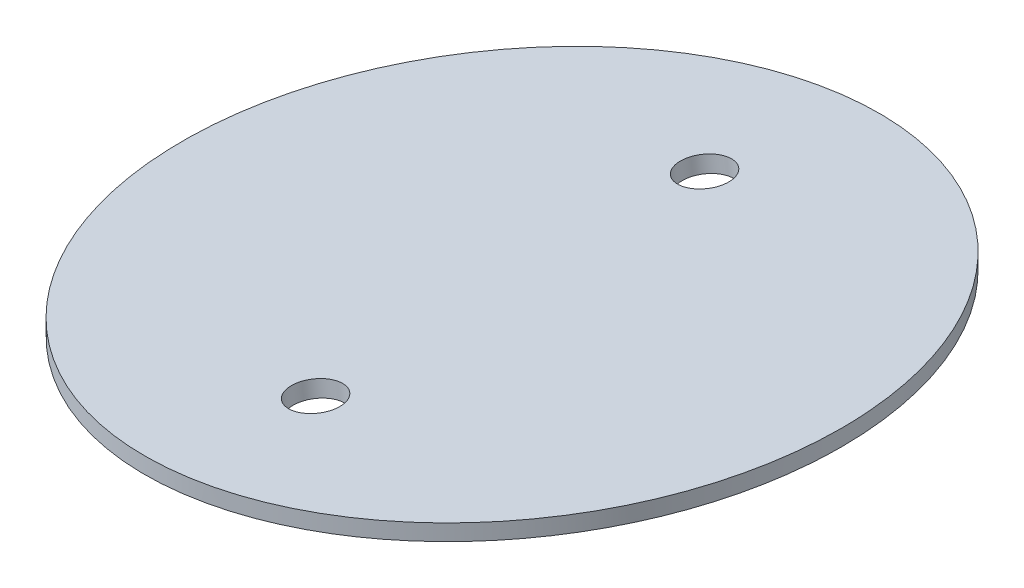
from build123d import *

# Parameters (mm, degrees)
BOSS_EXTRUDE1_DEPTH     = 61
CUT_EXTRUDE7_DEPTH      = 69.401456719
CUT_EXTRUDE7_DEPTH_BACK = 69.401456719
CUT_EXTRUDE9_DEPTH      = 69.480850828
CUT_EXTRUDE9_DEPTH_BACK = 69.480850828
SKETCH11_R              = 2.25


with BuildPart() as part:
    # Sketch1 → Boss-Extrude1 (new body)
    with BuildSketch(Plane.XY):
        Polygon((-30.5, -2.244929108), (-30.5, -3.744929108), (30.5, 3.744929108), (30.5, 5.244929108), align=None)
    extrude(amount=BOSS_EXTRUDE1_DEPTH)

    # Sketch7 → Cut-Extrude7 (cut, two sides: drawn at the far end of the back side and taken through both)
    with BuildSketch(Plane(origin=(0, 0, 0), x_dir=(1, 0, 0), z_dir=(0, 1, 0)).offset(-CUT_EXTRUDE7_DEPTH_BACK)):
        with BuildLine():
            Line((9.4e-08, 0), (-30.5, 0))
            Line((-30.5, 0), (-30.5, -30.5))
            ThreePointArc((-30.5, -30.5), (-21.566756793, -8.933243141), (9.4e-08, 0))
        make_face()
        with BuildLine():
            Line((30.5, 0), (9.4e-08, 0))
            ThreePointArc((9.4e-08, 0), (21.566756859, -8.933243207), (30.5, -30.5))
            Line((30.5, -30.5), (30.5, 0))
        make_face()
        with BuildLine():
            ThreePointArc((-8e-09, -61), (-21.566756829, -52.066756823), (-30.5, -30.5))
            Line((-30.5, -30.5), (-30.5, -61))
            Line((-30.5, -61), (-8e-09, -61))
        make_face()
        with BuildLine():
            Line((30.5, -61), (30.5, -30.5))
            ThreePointArc((30.5, -30.5), (21.566756823, -52.066756829), (-8e-09, -61))
            Line((-8e-09, -61), (30.5, -61))
        make_face()
    extrude(amount=CUT_EXTRUDE7_DEPTH + CUT_EXTRUDE7_DEPTH_BACK, mode=Mode.SUBTRACT)

    # Sketch11 → Cut-Extrude9 (cut, two sides: drawn at the far end of the back side and taken through both)
    with BuildSketch(Plane(origin=(-0.181441422, 1.477721795, 0), x_dir=(0.992546151641322, 0.12186934340514832, 0), z_dir=(-0.12186934340514831, 0.9925461516413219, 0)).offset(-CUT_EXTRUDE9_DEPTH_BACK)):
        with Locations((0, -12.5)):
            Circle(SKETCH11_R)
        with Locations((0, -48.5)):
            Circle(SKETCH11_R)
    extrude(amount=CUT_EXTRUDE9_DEPTH + CUT_EXTRUDE9_DEPTH_BACK, mode=Mode.SUBTRACT)


solid = part.part
